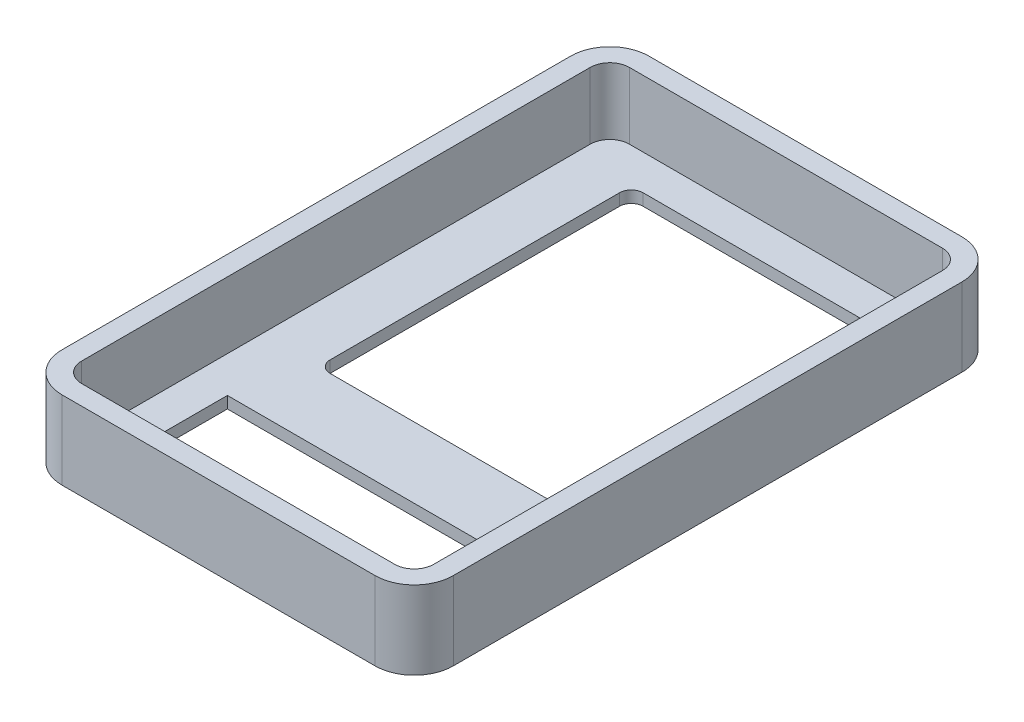
from build123d import *

# Parameters (mm, degrees)
BOSS_EXTRUDE1_DEPTH = 20
CUT_EXTRUDE1_DEPTH  = 17
SKETCH4_W           = 71.5
SKETCH4_H           = 26.25
CUT_EXTRUDE2_DEPTH  = 93.330926563


with BuildPart() as part:
    # Sketch1 → Boss-Extrude1 (new body)
    with BuildSketch(Plane(origin=(0, 0, 0), x_dir=(1, 0, 0), z_dir=(0, 1, 0))):
        with BuildLine():
            Line((-40, -75), (40, -75))
            ThreePointArc((40, -75), (47.071067812, -72.071067812), (50, -65))
            Line((50, -65), (50, 65))
            ThreePointArc((50, 65), (47.071067812, 72.071067812), (40, 75))
            Line((40, 75), (-40, 75))
            ThreePointArc((-40, 75), (-47.071067812, 72.071067812), (-50, 65))
            Line((-50, 65), (-50, -65))
            ThreePointArc((-50, -65), (-47.071067812, -72.071067812), (-40, -75))
        make_face()
    extrude(amount=BOSS_EXTRUDE1_DEPTH)

    # Sketch3 → Cut-Extrude1 (cut)
    with BuildSketch(Plane(origin=(0, 20, 0), x_dir=(1, 0, 0), z_dir=(0, 1, 0))):
        with BuildLine():
            Line((40, 70), (-40, 70))
            ThreePointArc((-40, 70), (-43.535533906, 68.535533906), (-45, 65))
            Line((-45, 65), (-45, -65))
            ThreePointArc((-45, -65), (-43.535533906, -68.535533906), (-40, -70))
            Line((-40, -70), (40, -70))
            ThreePointArc((40, -70), (43.535533906, -68.535533906), (45, -65))
            Line((45, -65), (45, 65))
            ThreePointArc((45, 65), (43.535533906, 68.535533906), (40, 70))
        make_face()
    extrude(amount=-CUT_EXTRUDE1_DEPTH, mode=Mode.SUBTRACT)

    # Sketch4 → Cut-Extrude2 (cut, through all)
    with BuildSketch(Plane.XZ):
        with BuildLine():
            Line((-27.5, -61), (27.5, -61))
            ThreePointArc((27.5, -61), (29.621320344, -60.121320344), (30.5, -58))
            Line((30.5, -58), (30.5, 16))
            ThreePointArc((30.5, 16), (29.621320344, 18.121320344), (27.5, 19))
            Line((27.5, 19), (-27.5, 19))
            ThreePointArc((-27.5, 19), (-29.621320344, 18.121320344), (-30.5, 16))
            Line((-30.5, 16), (-30.5, -58))
            ThreePointArc((-30.5, -58), (-29.621320344, -60.121320344), (-27.5, -61))
        make_face()
        with Locations((0, 50.125)):
            Rectangle(SKETCH4_W, SKETCH4_H)
    extrude(amount=-CUT_EXTRUDE2_DEPTH, mode=Mode.SUBTRACT)


solid = part.part
